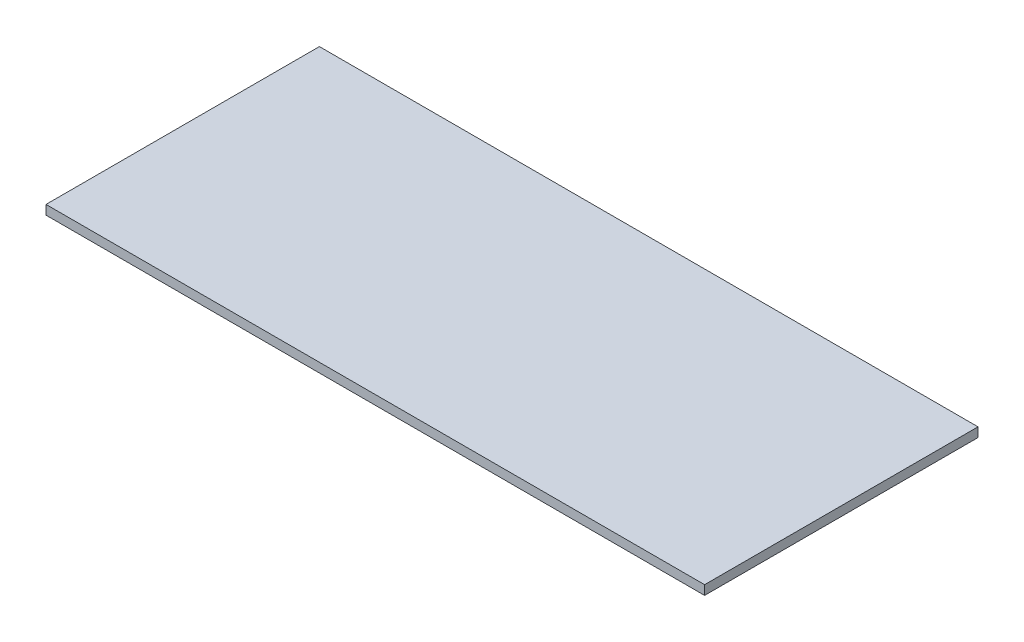
from build123d import *

# Parameters (mm, degrees)
SKETCH1_W           = 1346.2
SKETCH1_H           = 558.8
BOSS_EXTRUDE1_DEPTH = 19.05


with BuildPart() as part:
    # Sketch1 → Boss-Extrude1 (new body)
    with BuildSketch(Plane(origin=(0, 0, 0), x_dir=(1, 0, 0), z_dir=(0, 1, 0))):
        Rectangle(SKETCH1_W, SKETCH1_H)
    extrude(amount=BOSS_EXTRUDE1_DEPTH)


solid = part.part
